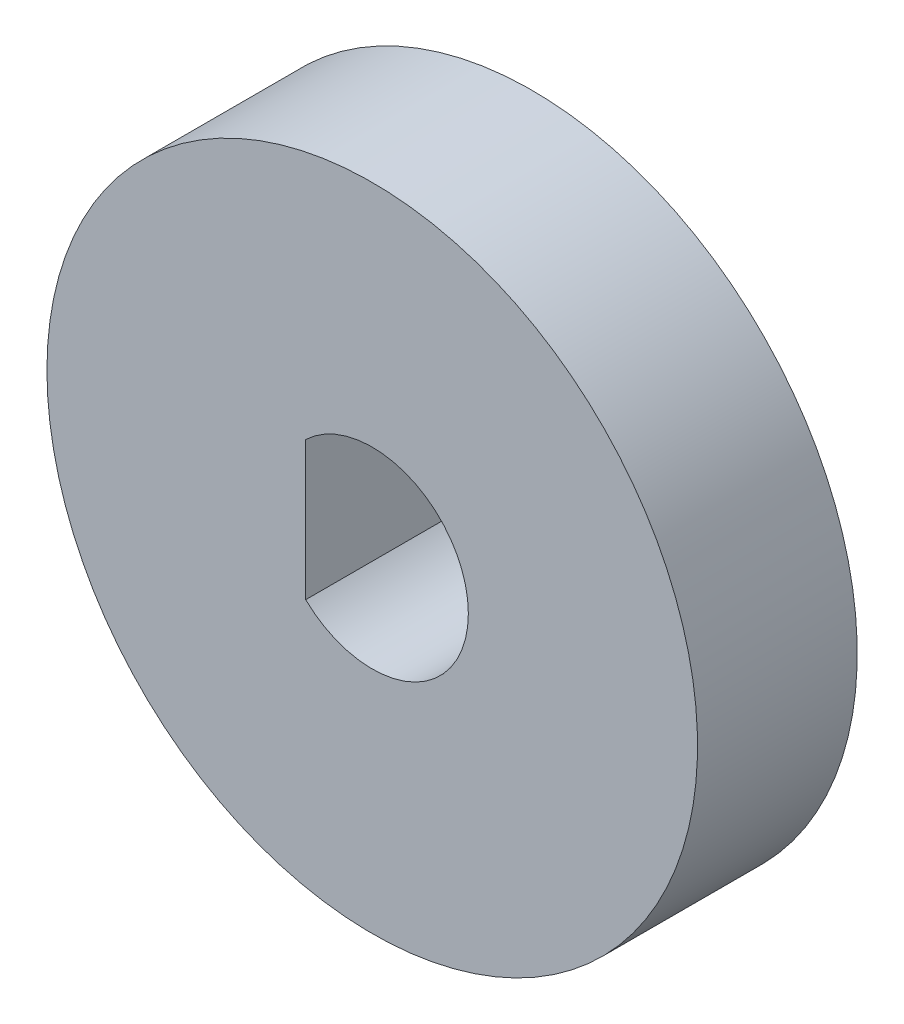
from build123d import *

# Parameters (mm, degrees)
SKETCH2_R           = 10.999999971
BOSS_EXTRUDE1_DEPTH = 5.4
CUT_EXTRUDE4_DEPTH  = 17.466936531


with BuildPart() as part:
    # Sketch2 → Boss-Extrude1 (new body)
    with BuildSketch(Plane.XY):
        with Locations(Location((0, 0, 0), (0, 0, 180))):
            Circle(SKETCH2_R)
    extrude(amount=BOSS_EXTRUDE1_DEPTH)

    # Sketch3 → Cut-Extrude4 (cut, through all)
    with BuildSketch(Plane(origin=(0, 0, 0), x_dir=(-1, 0, 0), z_dir=(0, 0, -1))):
        with BuildLine():
            ThreePointArc((2.25, -2.34520788), (-3.25, 0), (2.25, 2.34520788))
            Line((2.25, 2.34520788), (2.25, -2.34520788))
        make_face()
    extrude(amount=-CUT_EXTRUDE4_DEPTH, mode=Mode.SUBTRACT)


solid = part.part
